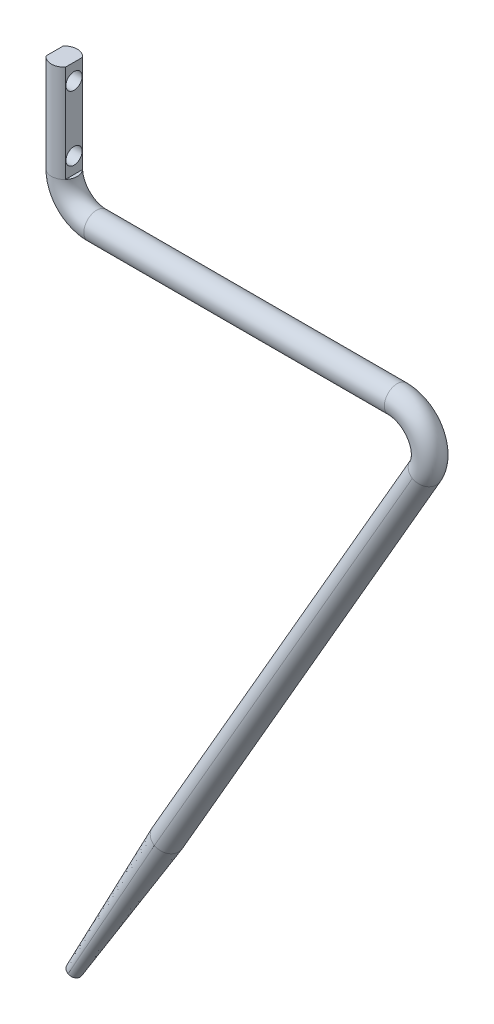
from build123d import *

# Parameters (mm, degrees)
SKETCH3_R             = 4
CHAMFER1_SIZE         = 2
CHAMFER1_SIZE2        = 57.272506566
SKETCH4_OUTSIDE_W     = 177.038
SKETCH4_OUTSIDE_H     = 64.358
SKETCH4_OUTSIDE_W_2   = 6
SKETCH4_OUTSIDE_H_2   = 35.530215116
EXTRUDE1_DEPTH        = 30
M6_TAPPED_HOLE1_D     = 5
M6_TAPPED_HOLE1_DEPTH = 9
M6_TAPPED_HOLE1_TIP   = 1.502151548


with BuildPart() as part:
    # Sweep1: sweep along a path in Sketch1
    with BuildLine(Plane.XY) as sweep1_path:
        Line((0, 40), (0, 10))
        ThreePointArc((0, 10), (2.928932188, 2.928932188), (10, 0))
        Line((10, 0), (102.679913944, 0))
        ThreePointArc((102.679913944, 0), (111.340115228, -4.999908629), (111.340273486, -14.999817256))
        Line((111.340273486, -14.999817256), (3.15, -202.4))
    # Sketch3 → Sweep1 (sweep)
    with BuildSketch(Plane(origin=(0, 40, 0), x_dir=(1, 0, 0), z_dir=(0, 1, 0))):
        Circle(SKETCH3_R)
    sweep(path=sweep1_path.line)

    # Chamfer1
    chamfer1_edges = [part.edges().sort_by_distance(p)[0] for p in [
        (-0.314143817, -200.400073098, 0),
    ]]
    chamfer1_side = [part.faces().sort_by_distance(p)[0] for p in [
        (3.15, -202.4, 0),
    ]]
    chamfer(chamfer1_edges, length=CHAMFER1_SIZE, length2=CHAMFER1_SIZE2, reference=chamfer1_side[0])

    # Sketch4 outside → Extrude1 (cut)
    with BuildSketch(Plane(origin=(0, 40, 0), x_dir=(1, 0, 0), z_dir=(0, 1, 0))):
        with Locations((56.34, 0)):
            Rectangle(SKETCH4_OUTSIDE_W, SKETCH4_OUTSIDE_H)
        Rectangle(SKETCH4_OUTSIDE_W_2, SKETCH4_OUTSIDE_H_2, mode=Mode.SUBTRACT)
    extrude(amount=-EXTRUDE1_DEPTH, mode=Mode.SUBTRACT)

    # M6 Tapped Hole1
    with Locations(Plane(origin=(3, 0, 0), x_dir=(0, 0, -1), z_dir=(1, 0, 0))):
        with Locations((0, 35), (0, 15)):
            Hole(M6_TAPPED_HOLE1_D / 2, depth=M6_TAPPED_HOLE1_DEPTH)
            with Locations((0, 0, -(M6_TAPPED_HOLE1_DEPTH + M6_TAPPED_HOLE1_TIP / 2))):  # 118° drill point
                Cone(0, M6_TAPPED_HOLE1_D / 2, M6_TAPPED_HOLE1_TIP, mode=Mode.SUBTRACT)


solid = part.part
